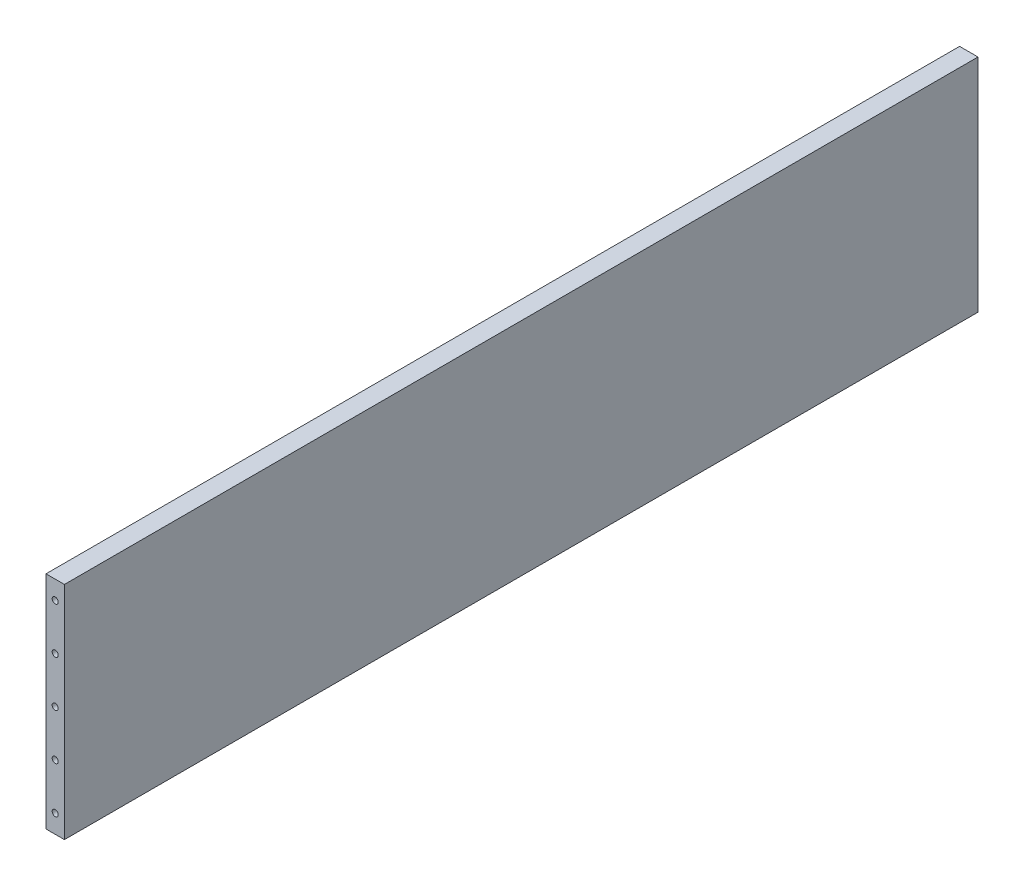
from build123d import *

# Parameters (mm, degrees)
SKETCH2_W             = 10
SKETCH2_H             = 120
BOSS_EXTRUDE1_DEPTH   = 496
M4_TAPPED_HOLE1_D     = 3.3
M4_TAPPED_HOLE1_DEPTH = 14.1
M4_TAPPED_HOLE1_TIP   = 0.991420021
M4_TAPPED_HOLE2_D     = 3.3
M4_TAPPED_HOLE2_DEPTH = 14.1
M4_TAPPED_HOLE2_TIP   = 0.991420021


with BuildPart() as part:
    # Sketch2 → Boss-Extrude1 (new body)
    with BuildSketch(Plane.XY):
        with Locations((-5, -60)):
            Rectangle(SKETCH2_W, SKETCH2_H)
    extrude(amount=BOSS_EXTRUDE1_DEPTH)

    # M4 Tapped Hole1
    with Locations(Plane(origin=(-5, -10, 496), x_dir=(1, 0, 0), z_dir=(0, 0, 1))):
        with Locations((0, 0), (0, -25), (0, -50), (0, -75), (0, -100)):
            Hole(M4_TAPPED_HOLE1_D / 2, depth=M4_TAPPED_HOLE1_DEPTH)
            with Locations((0, 0, -(M4_TAPPED_HOLE1_DEPTH + M4_TAPPED_HOLE1_TIP / 2))):  # 118° drill point
                Cone(0, M4_TAPPED_HOLE1_D / 2, M4_TAPPED_HOLE1_TIP, mode=Mode.SUBTRACT)

    # M4 Tapped Hole2
    with Locations(Plane(origin=(-5, -10, 0), x_dir=(-1, 0, 0), z_dir=(0, 0, -1))):
        with Locations((0, 0), (0, -25), (0, -50), (0, -75), (0, -100)):
            Hole(M4_TAPPED_HOLE2_D / 2, depth=M4_TAPPED_HOLE2_DEPTH)
            with Locations((0, 0, -(M4_TAPPED_HOLE2_DEPTH + M4_TAPPED_HOLE2_TIP / 2))):  # 118° drill point
                Cone(0, M4_TAPPED_HOLE2_D / 2, M4_TAPPED_HOLE2_TIP, mode=Mode.SUBTRACT)


solid = part.part
